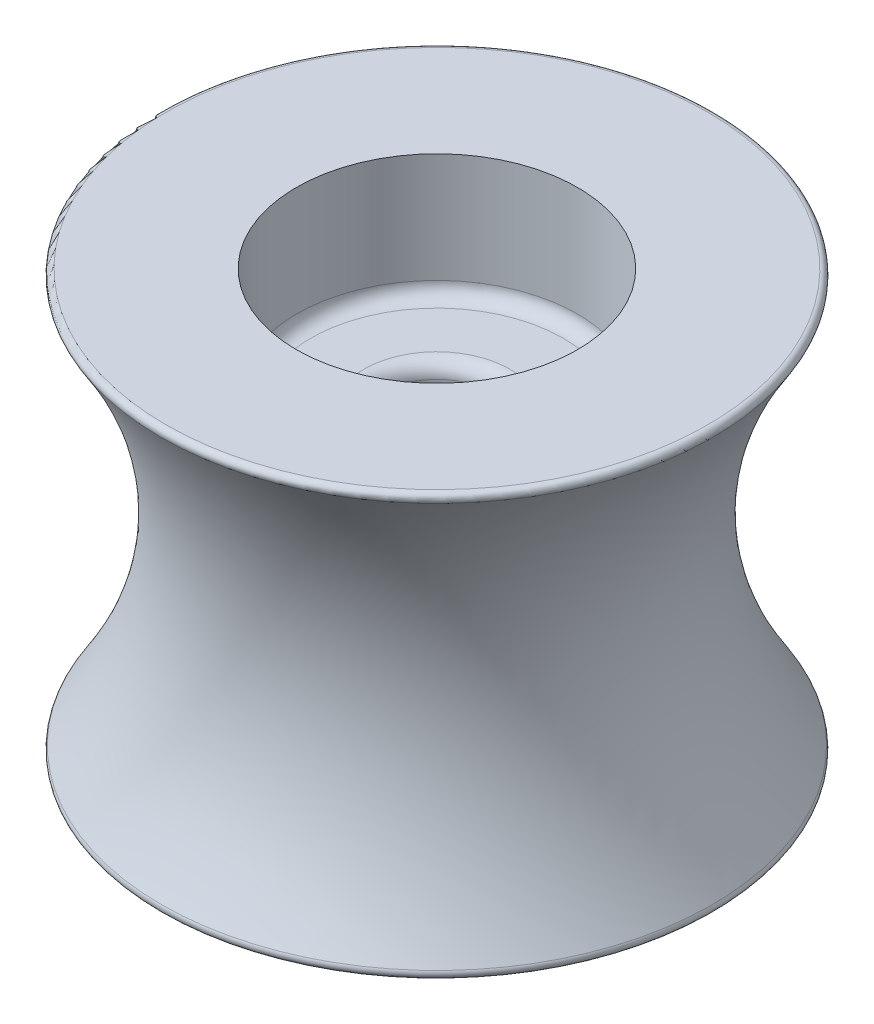
from build123d import *

# Parameters (mm, degrees)
CUT_EXTRUDE1_DEPTH      = 27.181720892
CUT_EXTRUDE1_DEPTH_BACK = 27.181720892
SKETCH2_R               = 2.667
SKETCH3_R               = 6.35
CUT_EXTRUDE2_DEPTH      = 5.588
FILLET1_R               = 0.254
FILLET2_R               = 0.635
FILLET3_R               = 0.635


with BuildPart() as part:
    # Sketch1 → Revolve2 (revolve)
    with BuildSketch(Plane.XY):
        with BuildLine():
            Line((0, 9.525), (0, -9.525))
            Line((0, -9.525), (12.7, -9.525))
            add(Edge.make_bspline(
                [(12.7, 9.525), (6.35, 0), (12.7, -9.525)],
                knots=[0, 0, 0, 1, 1, 1], degree=2))
            Line((12.7, 9.525), (0, 9.525))
        make_face()
    revolve(axis=Axis((0, 9.525, 0), (0, -1, 0)))

    # Sketch2 → Cut-Extrude1 (cut, two sides: drawn at the far end of the back side and taken through both)
    with BuildSketch(Plane(origin=(0, 9.525, 0), x_dir=(1, 0, 0), z_dir=(0, 1, 0)).offset(-CUT_EXTRUDE1_DEPTH_BACK)):
        with Locations(Location((0, 0, 0), (0, 0, 270))):
            Circle(SKETCH2_R)
    extrude(amount=CUT_EXTRUDE1_DEPTH + CUT_EXTRUDE1_DEPTH_BACK, mode=Mode.SUBTRACT)

    # Sketch3 → Cut-Extrude2 (cut)
    with BuildSketch(Plane(origin=(0, 9.525, 0), x_dir=(1, 0, 0), z_dir=(0, 1, 0))):
        with Locations(Location((0, 0, 0), (0, 0, 270))):
            Circle(SKETCH3_R)
    cut_extrude2 = extrude(amount=-CUT_EXTRUDE2_DEPTH, mode=Mode.SUBTRACT)

    # Mirror1: Cut-Extrude2 across plane
    add(cut_extrude2.mirror(Plane.ZX), mode=Mode.SUBTRACT)

    # Fillet1
    fillet1_edges = [part.edges().sort_by_distance(p)[0] for p in [
        (-12.7, -9.525, 0),
        (-12.7, 9.525, 0),
    ]]
    fillet(fillet1_edges, radius=FILLET1_R)

    # Fillet2
    fillet2_edges = [part.edges().sort_by_distance(p)[0] for p in [
        (0, 3.937, -6.35),
        (0, -3.937, -6.35),
    ]]
    fillet(fillet2_edges, radius=FILLET2_R)

    # Fillet3
    fillet3_edges = [part.edges().sort_by_distance(p)[0] for p in [
        (0, 3.937, -2.667),
        (0, -3.937, -2.667),
    ]]
    fillet(fillet3_edges, radius=FILLET3_R)


solid = part.part
